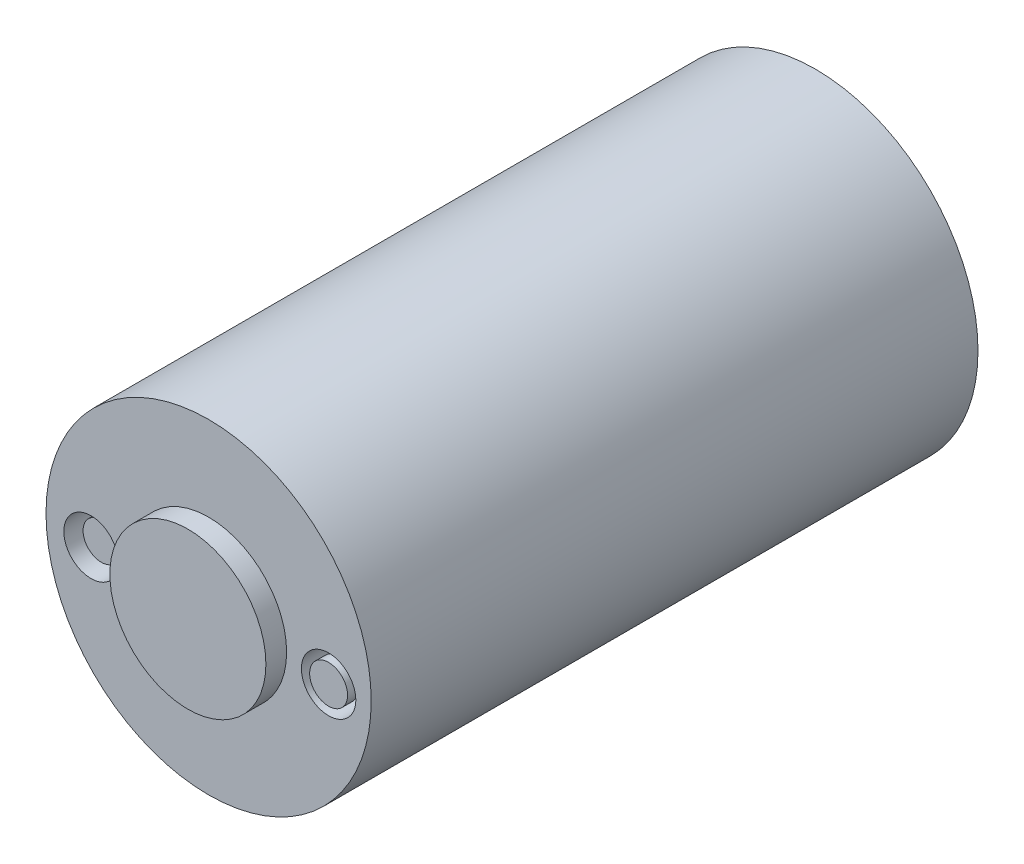
from build123d import *

# Parameters (mm, degrees)
SKETCH_1_R          = 31.385
EXTRUDE_1_DEPTH     = 110.22
SKETCH_2_R          = 15.06
EXTRUDE_2_DEPTH     = 4
SKETCH_3_R          = 5.255
CUT_EXTRUDE_1_DEPTH = 10
SKETCH_4_R          = 3.541157085
EXTRUDE_3_DEPTH     = 8
SKETCH_5_R          = 3.664484838
EXTRUDE_6_DEPTH     = 2
EXTRUDE_START       = 6.91
SKETCH_6_R          = 31.385
EXTRUDE_7_DEPTH     = 6.91


with BuildPart() as part:
    # 草图1 → 凸台-拉伸1 (new body)
    with BuildSketch(Plane.XY):
        with Locations((-27.409245033, 9.476020806)):
            Circle(SKETCH_1_R)
    extrude(amount=EXTRUDE_1_DEPTH)

    # 草图2 → 凸台-拉伸2 (add)
    with BuildSketch(Plane.XY.offset(110.22)):
        with Locations((-27.409245033, 9.476020806)):
            Circle(SKETCH_2_R)
    extrude(amount=EXTRUDE_2_DEPTH)

    # 草图3 → 切除-拉伸1 (cut)
    with BuildSketch(Plane.XY.offset(110.22)):
        with Locations((-4.242782438, 8.164318367)):
            Circle(SKETCH_3_R)
        with Locations((-50.097416885, 8.164318367)):
            Circle(SKETCH_3_R)
    extrude(amount=-CUT_EXTRUDE_1_DEPTH, mode=Mode.SUBTRACT)

    # 草图4 → 凸台-拉伸3 (add)
    with BuildSketch(Plane.XY.offset(100.22)):
        with Locations((-50.097416885, 8.164318367)):
            Circle(SKETCH_4_R)
    extrude(amount=EXTRUDE_3_DEPTH)

    # 草图6 → 凸台-拉伸7 (add)
    with BuildSketch(Plane(origin=(0, 0, 0), x_dir=(-1, 0, 0), z_dir=(0, 0, -1)).offset(EXTRUDE_START)):
        with Locations((27.409245033, 9.476020806)):
            Circle(SKETCH_6_R)
    extrude(amount=-EXTRUDE_7_DEPTH)


with BuildPart() as body_2:
    # 草图5 → 凸台-拉伸6 (new body)
    with BuildSketch(Plane.XY.offset(108.22)):
        with Locations((-4.242782438, 8.164318367)):
            Circle(SKETCH_5_R)
    extrude(amount=EXTRUDE_6_DEPTH)


solid = Compound([part.part, body_2.part])
